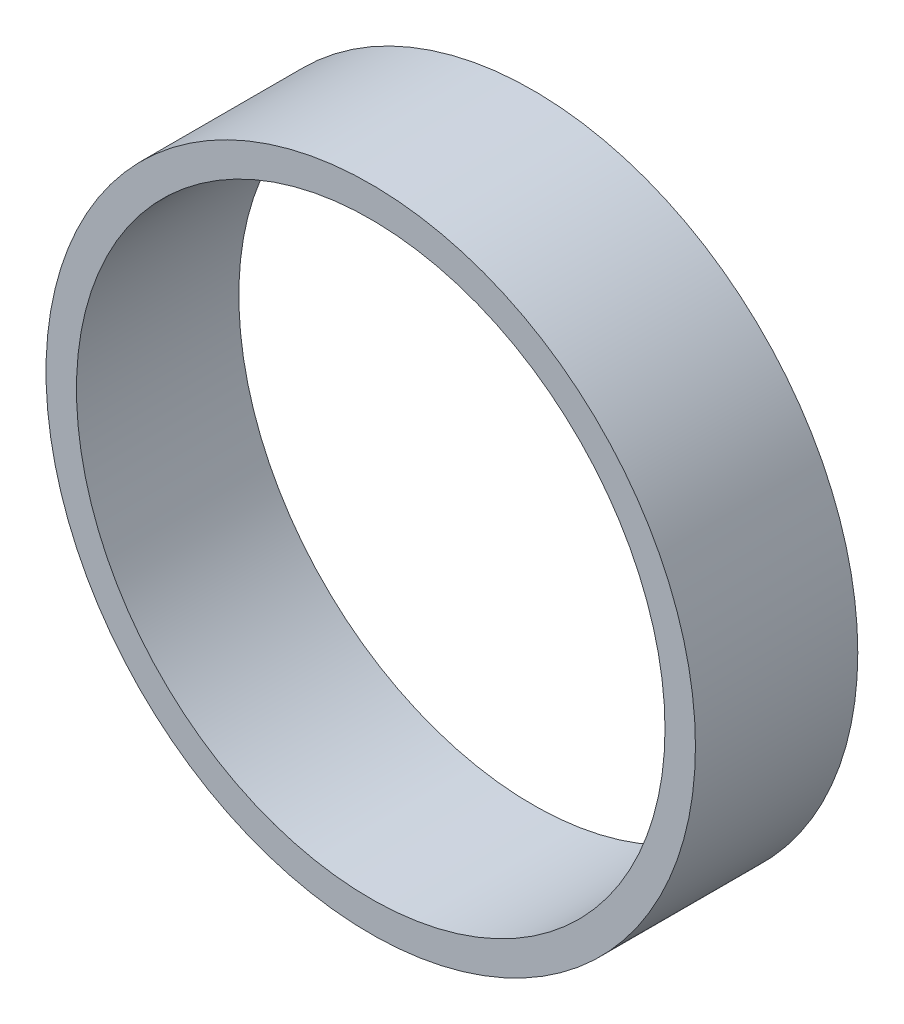
from build123d import *

# Parameters (mm, degrees)
SKETCH2_R           = 80
SKETCH2_R_2         = 72.5
BOSS_EXTRUDE1_DEPTH = 20


with BuildPart() as part:
    # Sketch2 → Boss-Extrude1 (new, symmetric)
    with BuildSketch(Plane.XY):
        Circle(SKETCH2_R)
        Circle(SKETCH2_R_2, mode=Mode.SUBTRACT)
    extrude(amount=BOSS_EXTRUDE1_DEPTH, both=True)


solid = part.part
